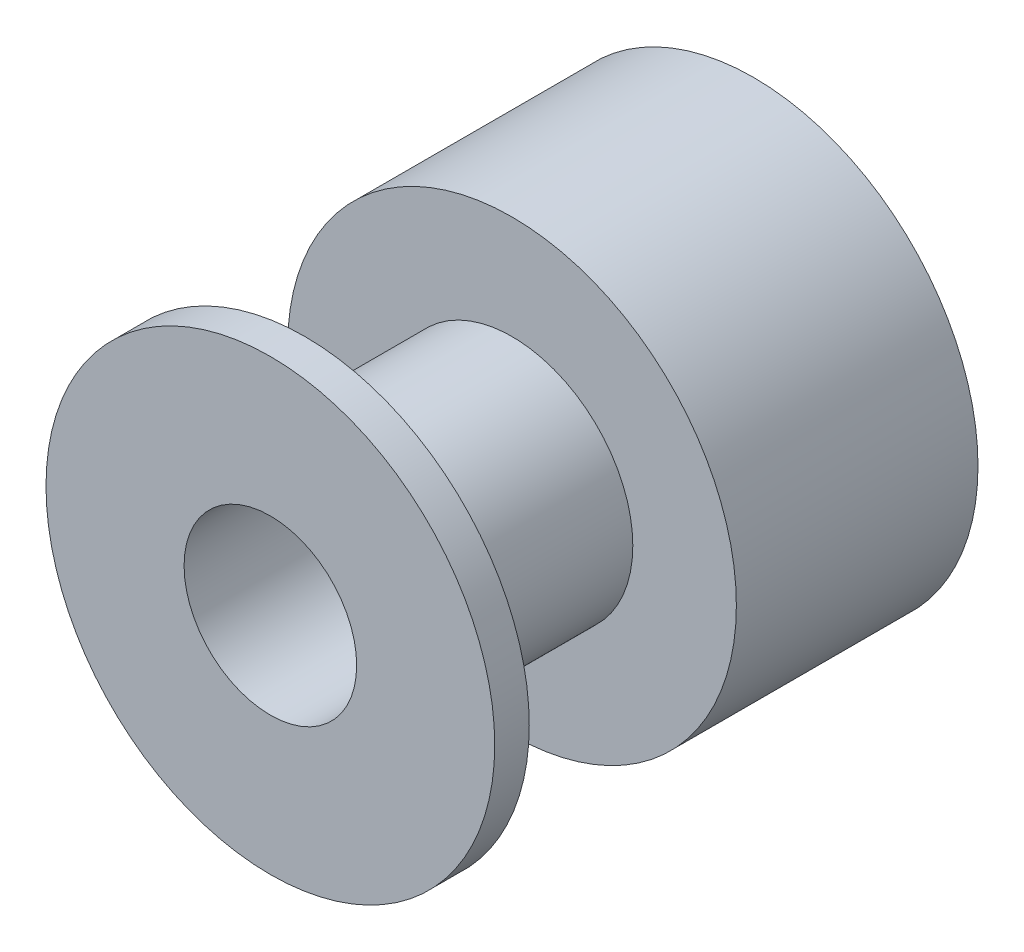
from build123d import *

# Parameters (mm, degrees)
SKETCH_1_R          = 6.5
EXTRUDE_1_DEPTH     = 1
SKETCH_2_R          = 3.5
EXTRUDE_2_DEPTH     = 6
EXTRUDE_START       = 7
SKETCH_3_R          = 6.5
EXTRUDE_3_DEPTH     = 7
SKETCH_4_R          = 2.5
CUT_EXTRUDE_1_DEPTH = 17.748134224


with BuildPart() as part:
    # Эскиз1 → Бобышка-Вытянуть1 (new body)
    with BuildSketch(Plane.XY):
        Circle(SKETCH_1_R)
    extrude(amount=EXTRUDE_1_DEPTH)

    # Эскиз2 → Бобышка-Вытянуть2 (add)
    with BuildSketch(Plane(origin=(0, 0, 0), x_dir=(-1, 0, 0), z_dir=(0, 0, -1))):
        with Locations(Location((0, 0, 0), (0, 0, 180))):
            Circle(SKETCH_2_R)
    extrude(amount=EXTRUDE_2_DEPTH)

    # Эскиз3 → Бобышка-Вытянуть3 (add)
    with BuildSketch(Plane(origin=(0, 0, -6), x_dir=(-1, 0, 0), z_dir=(0, 0, -1)).offset(EXTRUDE_START)):
        with Locations(Location((0, 0, 0), (0, 0, 180))):
            Circle(SKETCH_3_R)
    extrude(amount=-EXTRUDE_3_DEPTH)

    # Эскиз4 → Вырез-Вытянуть1 (cut, through all)
    with BuildSketch(Plane(origin=(0, 0, -13), x_dir=(-1, 0, 0), z_dir=(0, 0, -1))):
        Circle(SKETCH_4_R)
    extrude(amount=-CUT_EXTRUDE_1_DEPTH, mode=Mode.SUBTRACT)


solid = part.part
